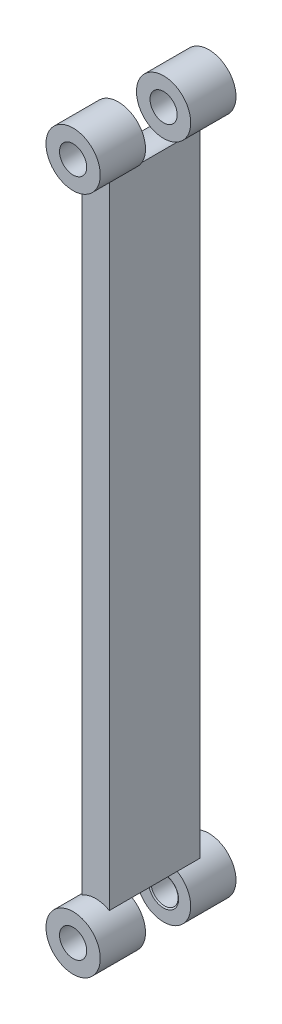
from build123d import *

# Parameters (mm, degrees)
SALIENTE_EXTRUIR1_DEPTH      = 5
SALIENTE_EXTRUIR1_DEPTH_BACK = 5
CROQUIS1_W                   = 3
CROQUIS1_H                   = 75
SALIENTE_EXTRUIR3_DEPTH      = 7.5
SALIENTE_EXTRUIR3_DEPTH_BACK = 7.5
CROQUIS1_4_R                 = 3
CROQUIS1_4_R_2               = 1.5
CORTAR_EXTRUIR1_DEPTH        = 2.5
CORTAR_EXTRUIR1_DEPTH_BACK   = 2.5
CROQUIS1_5_R                 = 3
CORTAR_EXTRUIR2_DEPTH        = 10
CORTAR_EXTRUIR2_DEPTH_BACK   = 10
CROQUIS1_6_R                 = 1.5


with BuildPart() as part:
    # Croquis1 → Saliente-Extruir1 (new, two sides: drawn at the far end of the back side and taken through both)
    with BuildSketch(Plane.XY.offset(-SALIENTE_EXTRUIR1_DEPTH_BACK)):
        Rectangle(CROQUIS1_W, CROQUIS1_H)
    extrude(amount=SALIENTE_EXTRUIR1_DEPTH + SALIENTE_EXTRUIR1_DEPTH_BACK)

    # Croquis1<4> → Saliente-Extruir3 (add, two sides: drawn at the far end of the back side and taken through both)
    # profile 1 of 2: a face of its own
    with BuildSketch(Plane.XY.offset(-SALIENTE_EXTRUIR3_DEPTH_BACK)):
        with Locations((0, 37.5)):
            Circle(CROQUIS1_4_R)
        with Locations((0, 37.5)):
            Circle(CROQUIS1_4_R_2, mode=Mode.SUBTRACT)
    # profile 2 of 2: a face of its own
    with BuildSketch(Plane.XY.offset(-SALIENTE_EXTRUIR3_DEPTH_BACK)):
        with Locations((0, -37.5)):
            Circle(CROQUIS1_4_R)
        with Locations((0, -37.5)):
            Circle(CROQUIS1_4_R_2, mode=Mode.SUBTRACT)
    extrude(amount=SALIENTE_EXTRUIR3_DEPTH + SALIENTE_EXTRUIR3_DEPTH_BACK)

    # Croquis1<5> → Cortar-Extruir1 (cut, two sides: drawn at the far end of the back side and taken through both)
    with BuildSketch(Plane.XY.offset(-CORTAR_EXTRUIR1_DEPTH_BACK)):
        with Locations((0, 37.5)):
            Circle(CROQUIS1_5_R)
        with Locations((0, -37.5)):
            Circle(CROQUIS1_5_R)
    extrude(amount=CORTAR_EXTRUIR1_DEPTH + CORTAR_EXTRUIR1_DEPTH_BACK, mode=Mode.SUBTRACT)

    # Croquis1<6> → Cortar-Extruir2 (cut, two sides: drawn at the far end of the back side and taken through both)
    with BuildSketch(Plane.XY.offset(-CORTAR_EXTRUIR2_DEPTH_BACK)):
        with Locations((0, 37.5)):
            Circle(CROQUIS1_6_R)
        with Locations((0, -37.5)):
            Circle(CROQUIS1_6_R)
    extrude(amount=CORTAR_EXTRUIR2_DEPTH + CORTAR_EXTRUIR2_DEPTH_BACK, mode=Mode.SUBTRACT)

    # Croquis1<11> → Cortar-Revolución2 (revolve, cut)
    with BuildSketch(Plane.XY):
        with BuildLine():
            ThreePointArc((-3, -37.5), (0, -40.5), (3, -37.5))
            Line((3, -37.5), (-3, -37.5))
        make_face()
    revolve(axis=Axis((3, -37.5, 0), (-1, 0, 0)), mode=Mode.SUBTRACT)


solid = part.part
